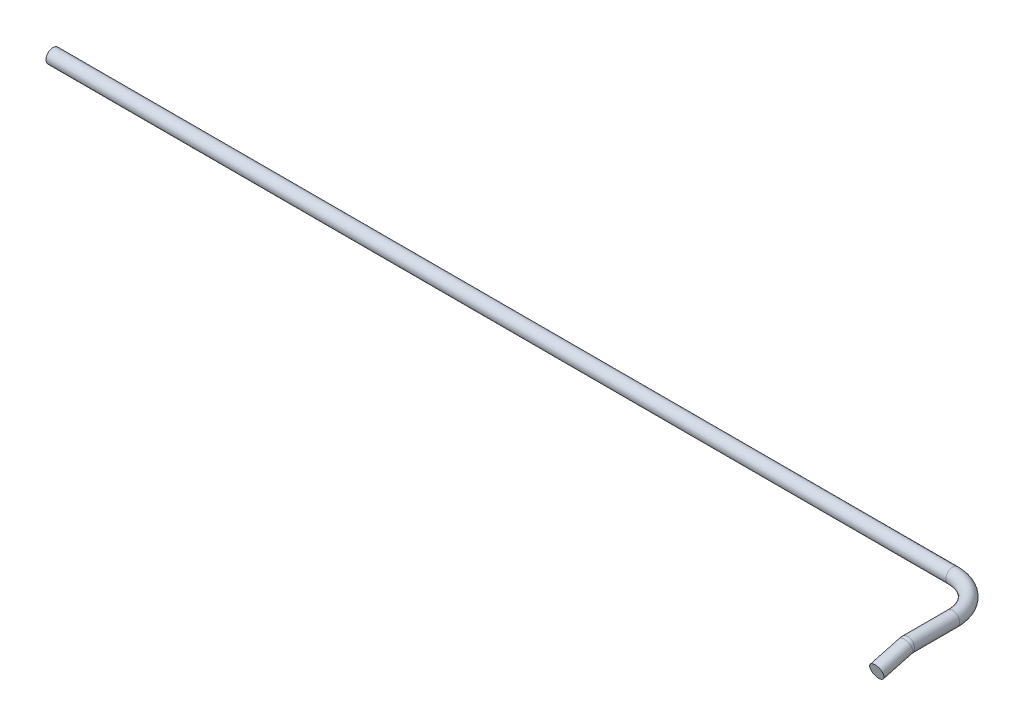
from build123d import *

# Parameters (mm, degrees)
SKETCH1_R           = 1.1811
RODEND_DEPTH        = 7.62
SKETCH4_R           = 1.1811
REVOLVE1_ANGLE      = 90
SKETCH5_R           = 1.1811
BOSS_EXTRUDE1_DEPTH = 152.4
SKETCH6_R           = 1.1811
REVOLVE2_ANGLE      = 15
SKETCH7_R           = 1.1811
BOSS_EXTRUDE2_DEPTH = 5.08


with BuildPart() as part:
    # Sketch1 → RodEnd (new body)
    with BuildSketch(Plane.XY):
        Circle(SKETCH1_R)
    extrude(amount=-RODEND_DEPTH)

    # Sketch4 → Revolve1 (revolve)
    with BuildSketch(Plane(origin=(0, 0, -7.62), x_dir=(-1, 0, 0), z_dir=(0, 0, -1))):
        with Locations(Location((0, 0, 0), (0, 0, 180))):
            Circle(SKETCH4_R)
    revolve(axis=Axis((-6.35, 0, -7.62), (0, 1, 0)), revolution_arc=REVOLVE1_ANGLE)

    # Sketch5 → Boss-Extrude1 (add)
    with BuildSketch(Plane.ZY.offset(6.35)):
        with Locations(Location((-13.97, 0, 0), (0, 0, 180))):
            Circle(SKETCH5_R)
    extrude(amount=BOSS_EXTRUDE1_DEPTH)

    # Sketch6 → Revolve2 (revolve)
    with BuildSketch(Plane.XY):
        Circle(SKETCH6_R)
    revolve(axis=Axis((0, -1.27, 0), (1, 0, 0)), revolution_arc=REVOLVE2_ANGLE)

    # Sketch7 → Boss-Extrude2 (add)
    with BuildSketch(Plane(origin=(0, -0.085073869, 0.3175), x_dir=(-1, 0, 0), z_dir=(0, -0.25881904510252135, 0.9659258262890682))):
        with Locations(Location((0, -0.043274201, 0), (0, 0, 270))):
            Circle(SKETCH7_R)
    extrude(amount=BOSS_EXTRUDE2_DEPTH)


solid = part.part
